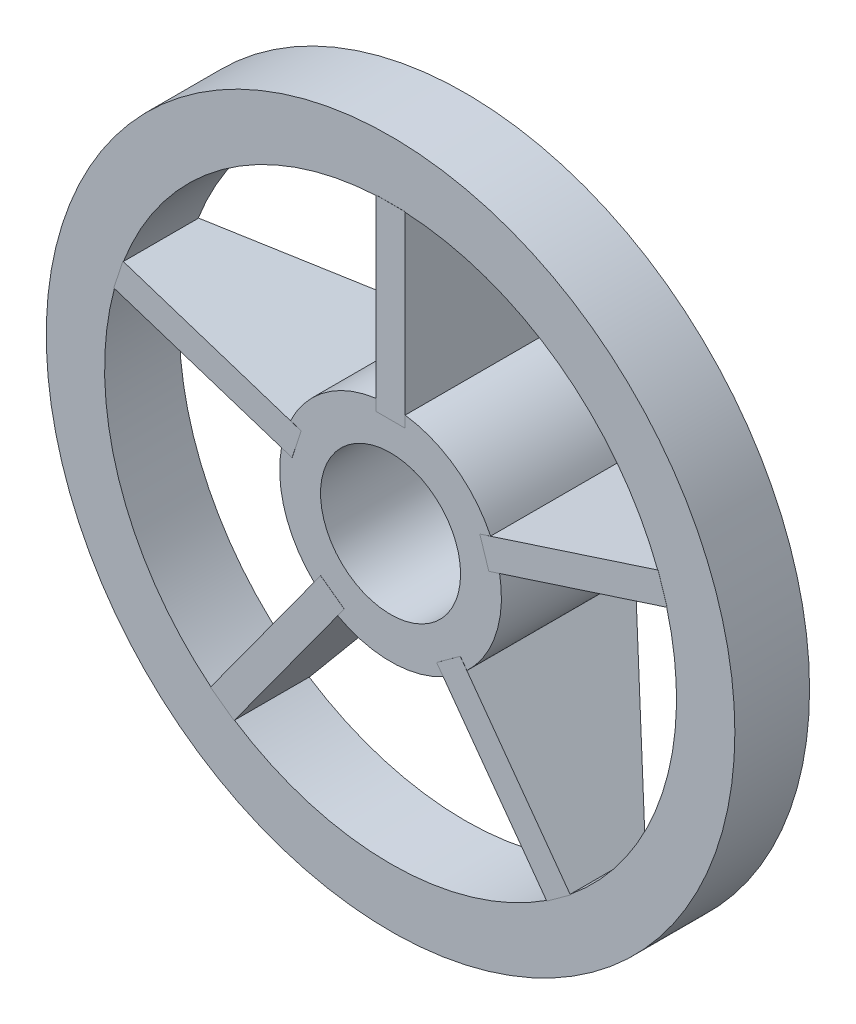
from build123d import *

# Parameters (mm, degrees)
SKETCH1_R           = 11.875
SKETCH1_R_2         = 7.5
BOSS_EXTRUDE1_DEPTH = 18
SKETCH2_R           = 36.875
SKETCH2_R_2         = 30.625
BOSS_EXTRUDE2_DEPTH = 8
BOSS_EXTRUDE3_DEPTH = 1.5625
CIRPATTERN1_COUNT   = 5


with BuildPart() as part:
    # Sketch1 → Boss-Extrude1 (new body)
    with BuildSketch(Plane.XY):
        Circle(SKETCH1_R)
        Circle(SKETCH1_R_2, mode=Mode.SUBTRACT)
    extrude(amount=BOSS_EXTRUDE1_DEPTH)



with BuildPart() as body_2:
    # Sketch2 → Boss-Extrude2 (new body)
    with BuildSketch(Plane.XY.offset(18)):
        Circle(SKETCH2_R)
        Circle(SKETCH2_R_2, mode=Mode.SUBTRACT)
    extrude(amount=-BOSS_EXTRUDE2_DEPTH)


with BuildPart() as part_1:
    add(part.part)

    add(body_2.part)  # Boss-Extrude3 merges body 2
    # Sketch3 → Boss-Extrude3 (add, symmetric)
    with BuildSketch(Plane(origin=(0, 0, 0), x_dir=(0, 0, -1), z_dir=(1, 0, 0))):
        Polygon((-18.011246249, 30.640460967), (-9.980663523, 30.640460967), (0, 11.819563663), (0, 10.569563663), (-18.011246249, 10.569563663), (-18.011246249, 11.819563663), align=None)
    boss_extrude3 = extrude(amount=BOSS_EXTRUDE3_DEPTH, both=True)

    # CirPattern1: Boss-Extrude3 ×5 about axis
    cirpattern1_axis = Axis((0, 0, 0), (0, 0, 1))
    for i in range(1, CIRPATTERN1_COUNT):
        add(boss_extrude3.rotate(cirpattern1_axis, i * 360 / CIRPATTERN1_COUNT))


solid = part_1.part
